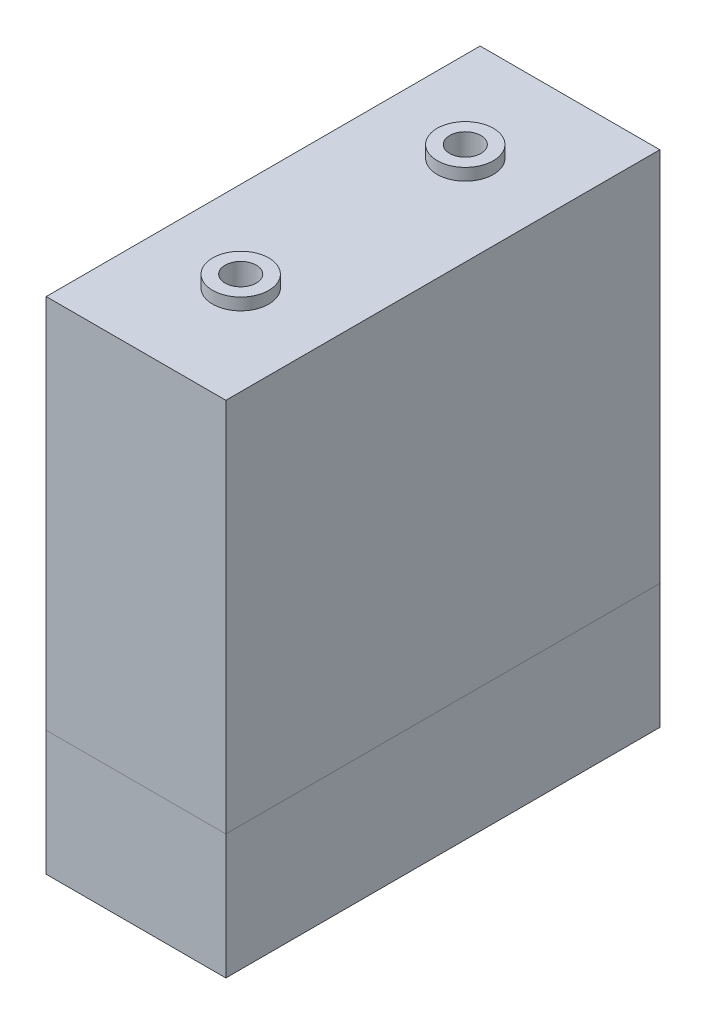
from build123d import *

# Parameters (mm, degrees)
SKETCH1_W           = 72
SKETCH1_H           = 173.9
BOSS_EXTRUDE1_DEPTH = 200.5
SKETCH2_R           = 11.25
BOSS_EXTRUDE2_DEPTH = 4.8
SKETCH6_R           = 6.25
CUT_EXTRUDE1_DEPTH  = 10


with BuildPart() as part:
    # Sketch1 → Boss-Extrude1 (new body)
    with BuildSketch(Plane(origin=(0, 0, 0), x_dir=(1, 0, 0), z_dir=(0, 1, 0))):
        with Locations((36, 86.95)):
            Rectangle(SKETCH1_W, SKETCH1_H)
    extrude(amount=BOSS_EXTRUDE1_DEPTH)

    # Sketch2 → Boss-Extrude2 (add)
    with BuildSketch(Plane(origin=(0, 200.5, 0), x_dir=(1, 0, 0), z_dir=(0, 1, 0))):
        with Locations(Location((36, 131.95, 0), (0, 0, 90))):
            Circle(SKETCH2_R)
        with Locations(Location((36, 41.95, 0), (0, 0, 90))):
            Circle(SKETCH2_R)
    extrude(amount=BOSS_EXTRUDE2_DEPTH)


with BuildPart() as body_2:
    # Split1: the piece on the far side of the plane
    add(part.part)
    split(bisect_by=Plane(origin=(0, 50, 0), x_dir=(0, 0, -1), z_dir=(0, -1, 0)), keep=Keep.BOTTOM)

    # Sketch6 → Cut-Extrude1 (cut)
    with BuildSketch(Plane(origin=(0, 205.3, 0), x_dir=(1, 0, 0), z_dir=(0, 1, 0))):
        with Locations(Location((36, 131.95, 0), (0, 0, 270))):
            Circle(SKETCH6_R)
        with Locations(Location((36, 41.95, 0), (0, 0, 270))):
            Circle(SKETCH6_R)
    extrude(amount=-CUT_EXTRUDE1_DEPTH, mode=Mode.SUBTRACT)


with BuildPart() as part_1:
    add(part.part)

    # Split1
    split(bisect_by=Plane(origin=(0, 50, 0), x_dir=(0, 0, -1), z_dir=(0, -1, 0)), keep=Keep.TOP)


solid = Compound([body_2.part, part_1.part])
